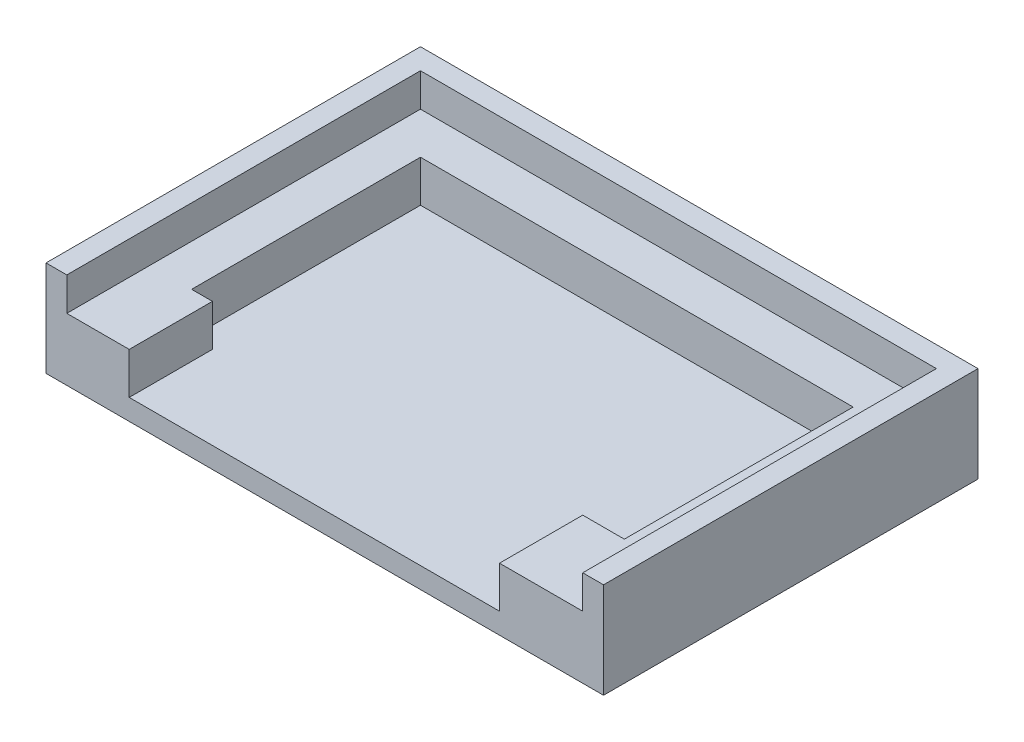
from build123d import *

# Parameters (mm, degrees)
SKETCH_1_W      = 134
SKETCH_1_H      = 90
EXTRUDE_1_DEPTH = 5
EXTRUDE_2_DEPTH = 10
EXTRUDE_3_DEPTH = 8


with BuildPart() as part:
    # Эскиз1 → Бобышка-Вытянуть1 (new body)
    with BuildSketch(Plane(origin=(0, 0, 0), x_dir=(1, 0, 0), z_dir=(0, 1, 0))):
        Rectangle(SKETCH_1_W, SKETCH_1_H)
    extrude(amount=EXTRUDE_1_DEPTH)

    # Эскиз2 → Бобышка-Вытянуть2 (add)
    with BuildSketch(Plane(origin=(0, 5, 0), x_dir=(1, 0, 0), z_dir=(0, 1, 0))):
        Polygon((-51.5, -45), (-47, -45), (-47, -25), (-52, -25), (-52, 30), (52, 30), (52, -25), (42, -25), (42, -45), (51.5, -45), (67, -45), (67, -25), (67, 30), (67, 45), (51.5, 45), (-51.5, 45), (-67, 45), (-67, 30), (-67, -25), (-67, -45), align=None)
    extrude(amount=EXTRUDE_2_DEPTH)

    # Эскиз3 → Бобышка-Вытянуть3 (add)
    with BuildSketch(Plane(origin=(0, 15, 0), x_dir=(1, 0, 0), z_dir=(0, 1, 0))):
        Polygon((62, -45), (67, -45), (67, 40), (67, 45), (61.5, 45), (-61.5, 45), (-67, 45), (-67, 40), (-67, -45), (-62, -45), (-62, 40), (62, 40), align=None)
    extrude(amount=EXTRUDE_3_DEPTH)


solid = part.part
